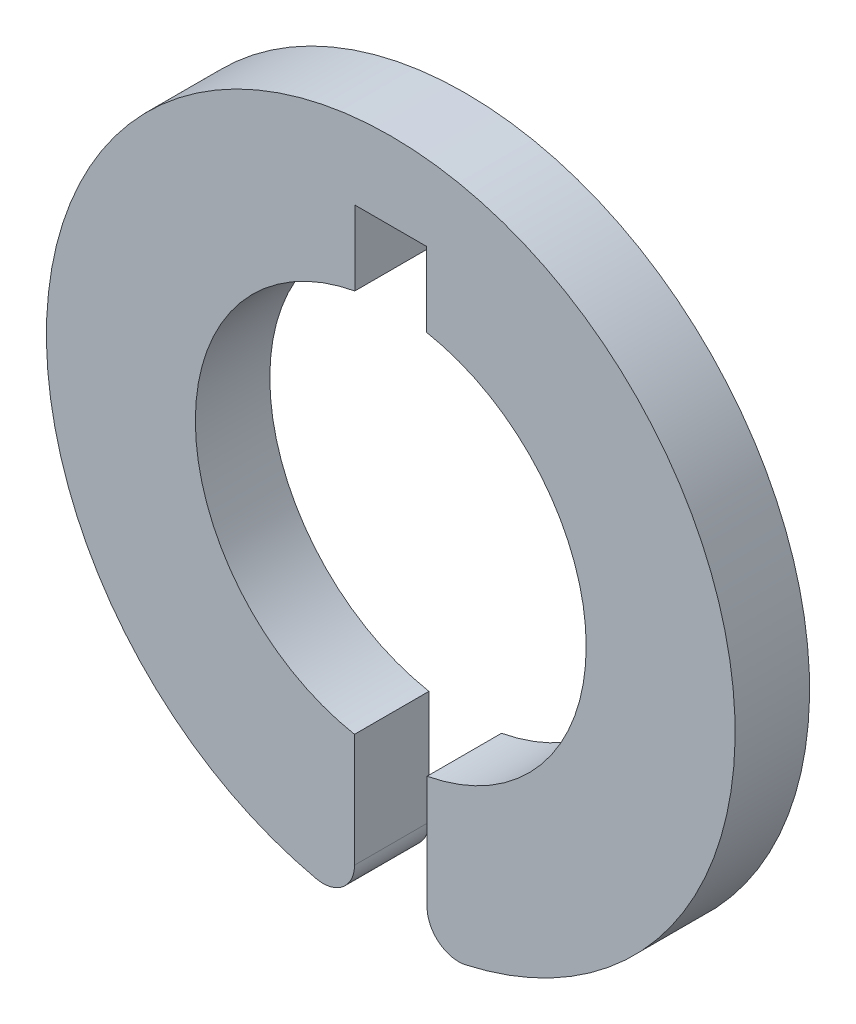
from build123d import *

# Parameters (mm, degrees)
EXTRUDE_1_DEPTH = 3
FILLET_1_R      = 1.27


with BuildPart() as part:
    # 스케치1 → 보스-돌출1 (new body)
    with BuildSketch(Plane.XY):
        with BuildLine():
            Line((-1.4475, 10.739807475), (1.4475, 10.739807475))
            Line((1.4475, 10.739807475), (1.4475, 7.739807475))
            ThreePointArc((1.4475, 7.739807475), (7.873996302, 0.007631422), (1.4625, -7.736987124))
            Line((1.4625, -7.736987124), (1.4625, -13.796701408))
            ThreePointArc((1.4625, -13.796701408), (0, 13.874), (-1.4625, -13.796701408))
            Line((-1.4625, -13.796701408), (-1.4625, -7.736987124))
            ThreePointArc((-1.4625, -7.736987124), (-7.873996302, 0.007631422), (-1.4475, 7.739807475))
            Line((-1.4475, 7.739807475), (-1.4475, 10.739807475))
        make_face()
    extrude(amount=EXTRUDE_1_DEPTH)

    # 필렛1
    fillet_1_edges = [part.edges().sort_by_distance(p)[0] for p in [
        (-1.4625, -13.796701408, 1.5),
        (1.4625, -13.796701408, 1.5),
    ]]
    fillet(fillet_1_edges, radius=FILLET_1_R)


solid = part.part
